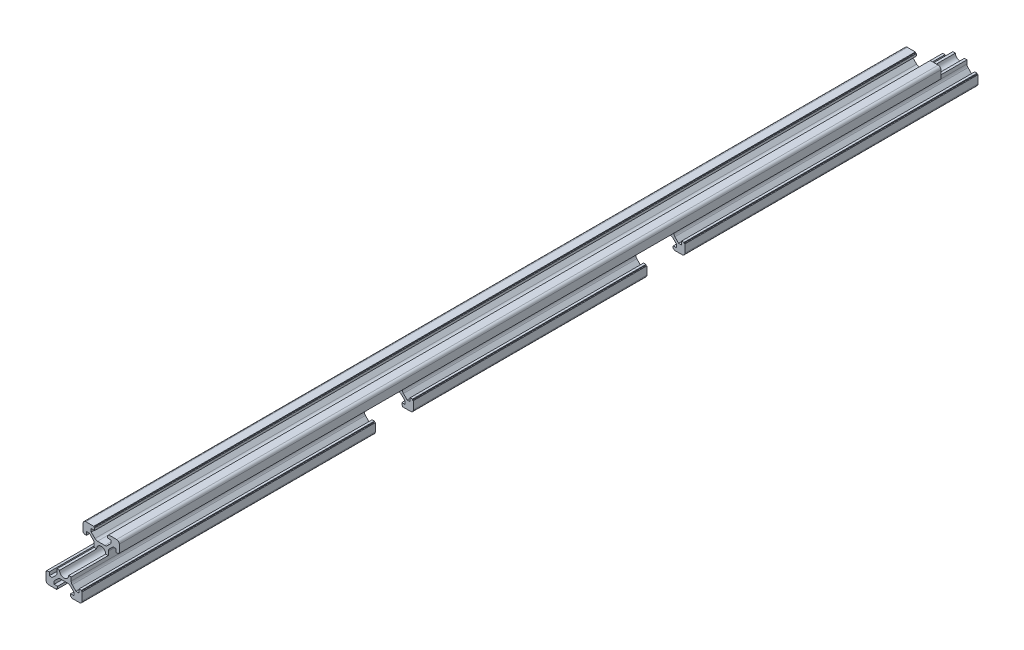
from build123d import *

# Parameters (mm, degrees)
SKETCH1_R           = 2.5
BOSS_EXTRUDE2_DEPTH = 495
SKETCH_1_W          = 21
SKETCH_1_H          = 10
SKETCH_1_W_2        = 20.5
CUT_EXTRUDE_1_DEPTH = 496.504793115


with BuildPart() as part:
    # Sketch1 → Boss-Extrude2 (new body)
    with BuildSketch(Plane.XY):
        with BuildLine():
            Line((10, -4.1), (10, -8.5))
            ThreePointArc((10, -8.5), (9.560660172, -9.560660172), (8.5, -10))
            Line((8.5, -10), (4.1, -10))
            Line((4.1, -10), (4.1, -9.5))
            Line((4.1, -9.5), (3.6, -9.5))
            Line((3.6, -9.5), (3.6, -8.2))
            Line((3.6, -8.2), (5.5, -8.2))
            Line((5.5, -8.2), (5.5, -6.560660172))
            Line((5.5, -6.560660172), (3.425126266, -4.485786438))
            ThreePointArc((3.425126266, -4.485786438), (2.776279568, -4.052240935), (2.010912703, -3.9))
            Line((2.010912703, -3.9), (-2.010912703, -3.9))
            ThreePointArc((-2.010912703, -3.9), (-2.776279568, -4.052240935), (-3.425126266, -4.485786438))
            Line((-3.425126266, -4.485786438), (-5.5, -6.560660172))
            Line((-5.5, -6.560660172), (-5.5, -8.2))
            Line((-5.5, -8.2), (-3.6, -8.2))
            Line((-3.6, -8.2), (-3.6, -9.5))
            Line((-3.6, -9.5), (-4.1, -9.5))
            Line((-4.1, -9.5), (-4.1, -10))
            Line((-4.1, -10), (-8.5, -10))
            ThreePointArc((-8.5, -10), (-9.560660172, -9.560660172), (-10, -8.5))
            Line((-10, -8.5), (-10, -4.1))
            Line((-10, -4.1), (-9.5, -4.1))
            Line((-9.5, -4.1), (-9.5, -3.6))
            Line((-9.5, -3.6), (-8.2, -3.6))
            Line((-8.2, -3.6), (-8.2, -5.5))
            Line((-8.2, -5.5), (-6.560660172, -5.5))
            Line((-6.560660172, -5.5), (-4.485786438, -3.425126266))
            ThreePointArc((-4.485786438, -3.425126266), (-4.052240935, -2.776279568), (-3.9, -2.010912703))
            Line((-3.9, -2.010912703), (-3.9, 2.010912703))
            ThreePointArc((-3.9, 2.010912703), (-4.052240935, 2.776279568), (-4.485786438, 3.425126266))
            Line((-4.485786438, 3.425126266), (-6.560660172, 5.5))
            Line((-6.560660172, 5.5), (-8.2, 5.5))
            Line((-8.2, 5.5), (-8.2, 3.6))
            Line((-8.2, 3.6), (-9.5, 3.6))
            Line((-9.5, 3.6), (-9.5, 4.1))
            Line((-9.5, 4.1), (-10, 4.1))
            Line((-10, 4.1), (-10, 8.5))
            ThreePointArc((-10, 8.5), (-9.560660172, 9.560660172), (-8.5, 10))
            Line((-8.5, 10), (-4.1, 10))
            Line((-4.1, 10), (-4.1, 9.5))
            Line((-4.1, 9.5), (-3.6, 9.5))
            Line((-3.6, 9.5), (-3.6, 8.2))
            Line((-3.6, 8.2), (-5.5, 8.2))
            Line((-5.5, 8.2), (-5.5, 6.560660172))
            Line((-5.5, 6.560660172), (-3.425126266, 4.485786438))
            ThreePointArc((-3.425126266, 4.485786438), (-2.776279568, 4.052240935), (-2.010912703, 3.9))
            Line((-2.010912703, 3.9), (2.010912703, 3.9))
            ThreePointArc((2.010912703, 3.9), (2.776279568, 4.052240935), (3.425126266, 4.485786438))
            Line((3.425126266, 4.485786438), (5.5, 6.560660172))
            Line((5.5, 6.560660172), (5.5, 8.2))
            Line((5.5, 8.2), (3.6, 8.2))
            Line((3.6, 8.2), (3.6, 9.5))
            Line((3.6, 9.5), (4.1, 9.5))
            Line((4.1, 9.5), (4.1, 10))
            Line((4.1, 10), (8.5, 10))
            ThreePointArc((8.5, 10), (9.560660172, 9.560660172), (10, 8.5))
            Line((10, 8.5), (10, 4.1))
            Line((10, 4.1), (9.5, 4.1))
            Line((9.5, 4.1), (9.5, 3.6))
            Line((9.5, 3.6), (8.2, 3.6))
            Line((8.2, 3.6), (8.2, 5.5))
            Line((8.2, 5.5), (6.560660172, 5.5))
            Line((6.560660172, 5.5), (4.485786438, 3.425126266))
            ThreePointArc((4.485786438, 3.425126266), (4.052240935, 2.776279568), (3.9, 2.010912703))
            Line((3.9, 2.010912703), (3.9, -2.010912703))
            ThreePointArc((3.9, -2.010912703), (4.052240935, -2.776279568), (4.485786438, -3.425126266))
            Line((4.485786438, -3.425126266), (6.560660172, -5.5))
            Line((6.560660172, -5.5), (8.2, -5.5))
            Line((8.2, -5.5), (8.2, -3.6))
            Line((8.2, -3.6), (9.5, -3.6))
            Line((9.5, -3.6), (9.5, -4.1))
            Line((9.5, -4.1), (10, -4.1))
        make_face()
        Circle(SKETCH1_R, mode=Mode.SUBTRACT)
    extrude(amount=BOSS_EXTRUDE2_DEPTH)

    # ｽｹｯﾁ1 → ｶｯﾄ - 押し出し1 (cut, through all)
    with BuildSketch(Plane.ZY.offset(10)):
        with Locations((172.5, -5)):
            Rectangle(SKETCH_1_W, SKETCH_1_H)
        with Locations((10.25, 5)):
            Rectangle(SKETCH_1_W_2, SKETCH_1_H)
        with Locations((484.75, 5)):
            Rectangle(SKETCH_1_W_2, SKETCH_1_H)
        with Locations((322.5, -5)):
            Rectangle(SKETCH_1_W, SKETCH_1_H)
    extrude(amount=-CUT_EXTRUDE_1_DEPTH, mode=Mode.SUBTRACT)


solid = part.part
